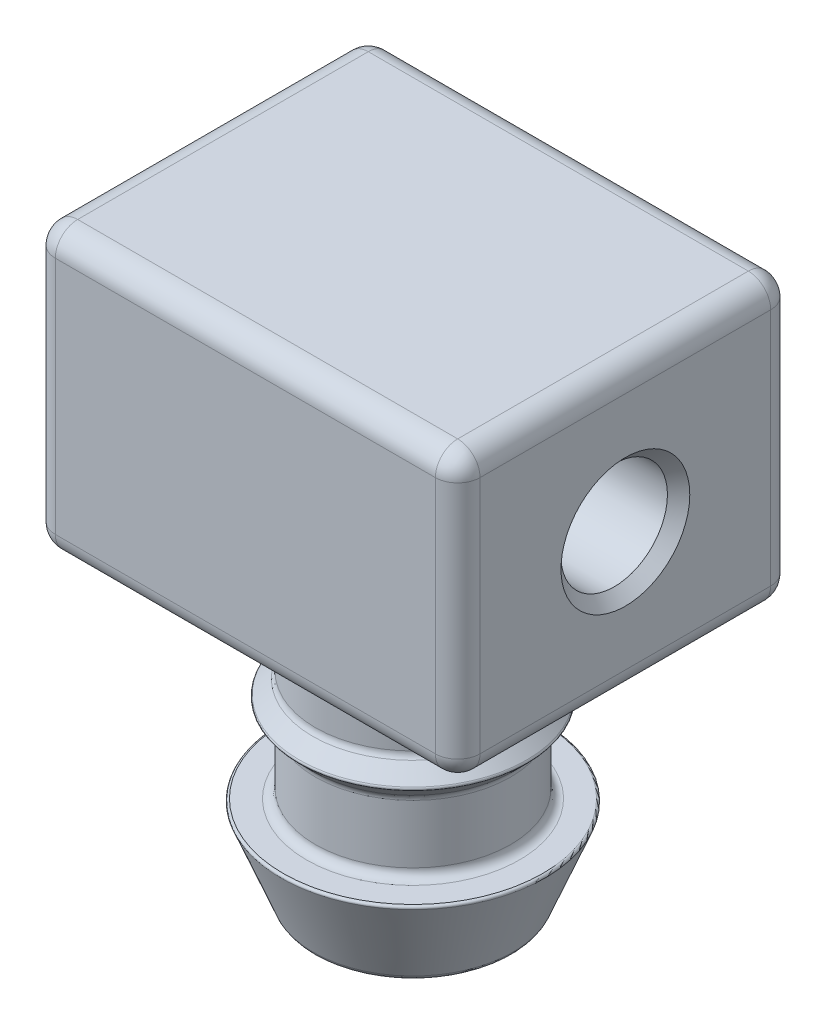
from build123d import *

# Parameters (mm, degrees)
SKETCH4_W               = 19
SKETCH4_H               = 15
BOSS_EXTRUDE1_DEPTH     = 12.7
CUT_EXTRUDE1_DEPTH      = 18.543944824
CUT_EXTRUDE1_DEPTH_BACK = 18.543944824
SKETCH2_R               = 2.38125
FILLET3_R               = 0.396875
FILLET4_R               = 0.09921875
CHAMFER1_SIZE           = 0.5
FILLET5_R               = 1


with BuildPart() as part:
    # Sketch1 → Revolve1 (revolve)
    with BuildSketch(Plane.XY, mode=Mode.PRIVATE) as revolve1_sk:
        Polygon((4.365625, -3.96875), (5.159375, -4.7625), (4.365625, -5.55625), (4.365625, -8.73125), (5.953125, -8.73125), (4.365625, -12.7), (0, -12.7), (0, 12.7), (5.3975, 12.7), (5.3975, 8.73125), (3.81, 8.73125), (3.81, 3.96875), (5.3975, 3.96875), (5.3975, 0), (4.365625, 0), align=None)
    revolve(revolve1_sk.sketch.rotate(Axis((0, 7.737700229, 0), (0, -1, 0)), 90), axis=Axis((0, 7.737700229, 0), (0, -1, 0)))

    # Sketch4 → Boss-Extrude1 (add)
    with BuildSketch(Plane(origin=(0, 12.7, 0), x_dir=(1, 0, 0), z_dir=(0, 1, 0))):
        Rectangle(SKETCH4_W, SKETCH4_H)
    extrude(amount=-BOSS_EXTRUDE1_DEPTH)

    # Sketch2 → Cut-Extrude1 (cut, two sides: drawn at the far end of the back side and taken through both)
    with BuildSketch(Plane(origin=(0, 0, 0), x_dir=(0, 0, -1), z_dir=(1, 0, 0)).offset(-CUT_EXTRUDE1_DEPTH_BACK)):
        with Locations((0, 6.35)):
            Circle(SKETCH2_R)
    extrude(amount=CUT_EXTRUDE1_DEPTH + CUT_EXTRUDE1_DEPTH_BACK, mode=Mode.SUBTRACT)

    # Fillet3
    fillet3_edges = [part.edges().sort_by_distance(p)[0] for p in [
        (0, -5.55625, -4.365625),
        (0, -8.73125, -4.365625),
        (0, -12.7, -4.365625),
        (0, 0, -4.365625),
        (0, -3.96875, -4.365625),
    ]]
    fillet(fillet3_edges, radius=FILLET3_R)

    # Fillet4
    fillet4_edges = [part.edges().sort_by_distance(p)[0] for p in [
        (0, -4.7625, -5.159375),
        (0, -8.73125, -5.953125),
    ]]
    fillet(fillet4_edges, radius=FILLET4_R)

    # Chamfer1
    chamfer1_edges = [part.edges().sort_by_distance(p)[0] for p in [
        (-9.5, 6.35, 2.38125),
        (9.5, 6.35, 2.38125),
    ]]
    chamfer(chamfer1_edges, length=CHAMFER1_SIZE)

    # Fillet5
    fillet5_edges = [part.edges().sort_by_distance(p)[0] for p in [
        (9.5, 0, 0),
        (9.5, 6.35, -7.5),
        (0, 0, 7.5),
        (9.5, 6.35, 7.5),
        (-9.5, 0, 0),
        (-9.5, 6.35, 7.5),
        (0, 0, -7.5),
        (-9.5, 6.35, -7.5),
        (9.5, 12.7, 0),
        (0, 12.7, -7.5),
        (-9.5, 12.7, 0),
        (0, 12.7, 7.5),
    ]]
    fillet(fillet5_edges, radius=FILLET5_R)


solid = part.part
